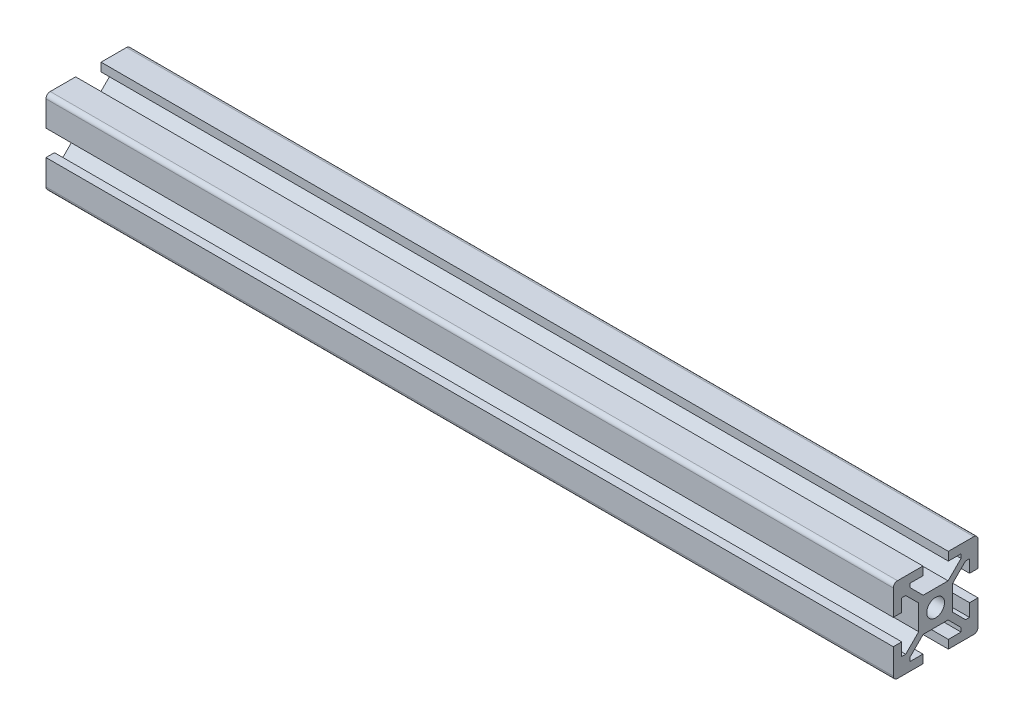
from build123d import *

# Parameters (mm, degrees)
SKETCH1_R              = 2.1
BOSS_EXTRUDE1_DEPTH    = 200
SKETCH_1_R             = 2.1
CUT_EXTRUDE_1_DEPTH    = 201.738636042
PATTERN_LINEAR_2_COUNT = 4
PATTERN_LINEAR_2_PITCH = 55


with BuildPart() as part:
    # Sketch1 → Boss-Extrude1 (new body)
    with BuildSketch(Plane(origin=(0, 0, 0), x_dir=(0, 0, -1), z_dir=(1, 0, 0))):
        with BuildLine():
            Line((-10, 9), (-10, 3))
            Line((-10, 3), (-8, 3))
            Line((-8, 3), (-8, 6))
            Line((-8, 6), (-7.060660172, 6))
            Line((-7.060660172, 6), (-4, 2.939339828))
            Line((-4, 2.939339828), (-4, -2.939339828))
            Line((-4, -2.939339828), (-7.060660172, -6))
            Line((-7.060660172, -6), (-8, -6))
            Line((-8, -6), (-8, -3))
            Line((-8, -3), (-10, -3))
            Line((-10, -3), (-10, -9))
            ThreePointArc((-10, -9), (-9.707106781, -9.707106781), (-9, -10))
            Line((-9, -10), (-3, -10))
            Line((-3, -10), (-3, -8))
            Line((-3, -8), (-6, -8))
            Line((-6, -8), (-6, -7.060660172))
            Line((-6, -7.060660172), (-2.939339828, -4))
            Line((-2.939339828, -4), (2.939339828, -4))
            Line((2.939339828, -4), (6, -7.060660172))
            Line((6, -7.060660172), (6, -8))
            Line((6, -8), (3, -8))
            Line((3, -8), (3, -10))
            Line((3, -10), (9, -10))
            ThreePointArc((9, -10), (9.707106781, -9.707106781), (10, -9))
            Line((10, -9), (10, -3))
            Line((10, -3), (8, -3))
            Line((8, -3), (8, -6))
            Line((8, -6), (7.060660172, -6))
            Line((7.060660172, -6), (4, -2.939339828))
            Line((4, -2.939339828), (4, 2.939339828))
            Line((4, 2.939339828), (7.060660172, 6))
            Line((7.060660172, 6), (8, 6))
            Line((8, 6), (8, 3))
            Line((8, 3), (10, 3))
            Line((10, 3), (10, 9))
            ThreePointArc((10, 9), (9.707106781, 9.707106781), (9, 10))
            Line((9, 10), (3, 10))
            Line((3, 10), (3, 8))
            Line((3, 8), (6, 8))
            Line((6, 8), (6, 7.060660172))
            Line((6, 7.060660172), (2.939339828, 4))
            Line((2.939339828, 4), (-2.939339828, 4))
            Line((-2.939339828, 4), (-6, 7.060660172))
            Line((-6, 7.060660172), (-6, 8))
            Line((-6, 8), (-3, 8))
            Line((-3, 8), (-3, 10))
            Line((-3, 10), (-9, 10))
            ThreePointArc((-9, 10), (-9.707106781, 9.707106781), (-10, 9))
        make_face()
        Circle(SKETCH1_R, mode=Mode.SUBTRACT)
    extrude(amount=BOSS_EXTRUDE1_DEPTH)

    # 草图1 → 切除-拉伸1 (cut, through all)
    with BuildSketch(Plane(origin=(0, 4, 0), x_dir=(1, 0, 0), z_dir=(0, 1, 0))):
        with Locations((15, 0.05)):
            Circle(SKETCH_1_R)
    cut_extrude_1 = extrude(amount=-CUT_EXTRUDE_1_DEPTH, mode=Mode.SUBTRACT)

    # 阵列(线性)2: 切除-拉伸1 ×4
    with Locations(*[(i * PATTERN_LINEAR_2_PITCH, 0, 0) for i in range(1, PATTERN_LINEAR_2_COUNT)]):
        add(cut_extrude_1, mode=Mode.SUBTRACT)


solid = part.part
